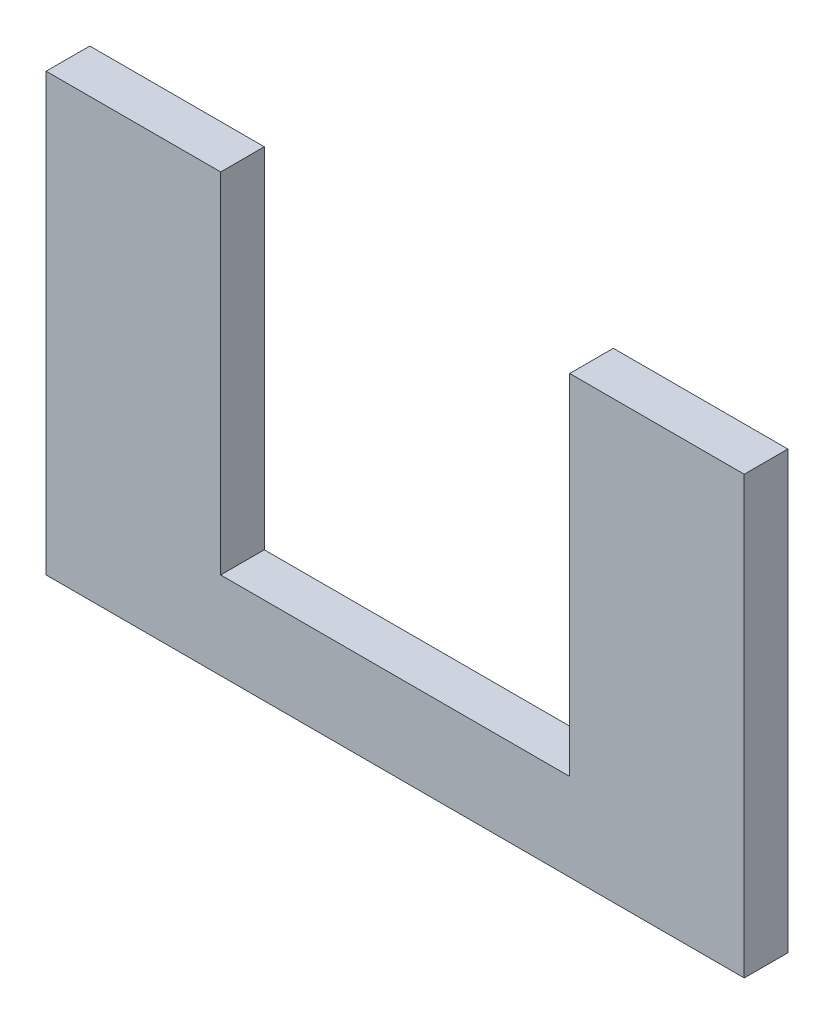
from build123d import *

# Parameters (mm, degrees)
BOSS_EXTRUDE1_DEPTH = 50
SKETCH2_W           = 40
SKETCH2_H           = 40
CUT_EXTRUDE1_DEPTH  = 50


with BuildPart() as part:
    # Sketch1 → Boss-Extrude1 (new body)
    with BuildSketch(Plane(origin=(0, 0, 0), x_dir=(1, 0, 0), z_dir=(0, 1, 0))):
        Polygon((40, -2.5), (40, 0), (40, 2.5), (-40, 2.5), (-40, -2.5), align=None)
    extrude(amount=BOSS_EXTRUDE1_DEPTH)

    # Sketch2 → Cut-Extrude1 (cut)
    with BuildSketch(Plane.XY.offset(2.5)):
        with Locations((0, 30)):
            Rectangle(SKETCH2_W, SKETCH2_H)
    extrude(amount=-CUT_EXTRUDE1_DEPTH, mode=Mode.SUBTRACT)


solid = part.part
